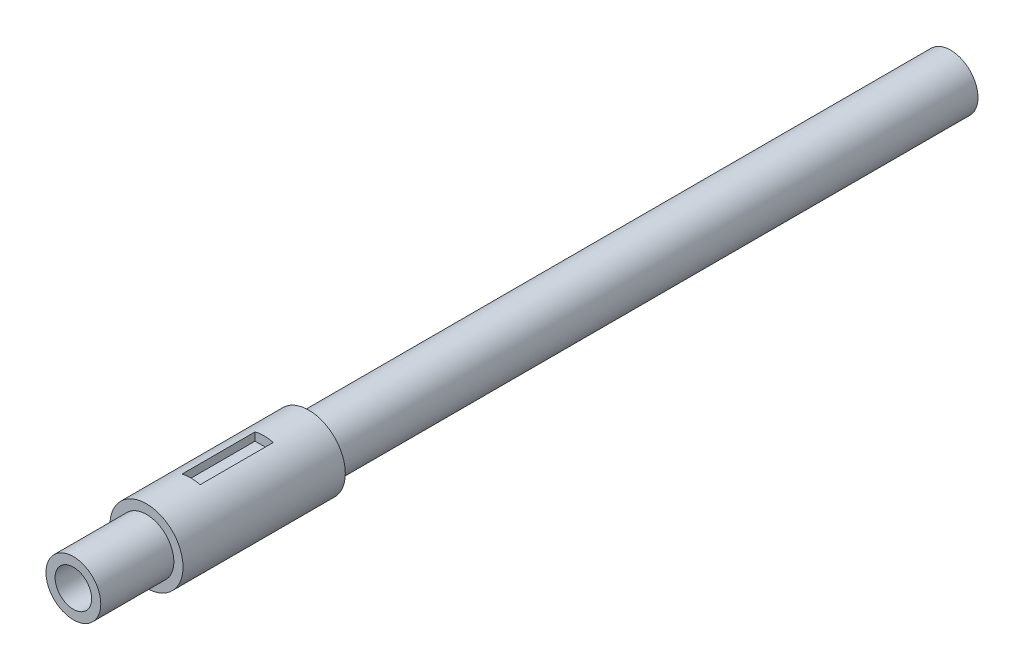
from build123d import *

# Parameters (mm, degrees)
SKETCH1_R           = 12.7
SKETCH1_R_2         = 6.35
BOSS_EXTRUDE1_DEPTH = 304.8
SKETCH3_R           = 19.05
SKETCH3_R_2         = 9.525
CUT_EXTRUDE2_DEPTH  = 254
CUT_EXTRUDE3_DEPTH  = 25.4
CUT_EXTRUDE5_START  = -25.4
SKETCH2_R           = 19.05
SKETCH2_R_2         = 9.525
CUT_EXTRUDE5_DEPTH  = 25.4


with BuildPart() as part:
    # Sketch1 → Boss-Extrude1 (new body)
    with BuildSketch(Plane.XY):
        Circle(SKETCH1_R)
        Circle(SKETCH1_R_2, mode=Mode.SUBTRACT)
    extrude(amount=-BOSS_EXTRUDE1_DEPTH)

    # Sketch3 → Cut-Extrude2 (cut)
    with BuildSketch(Plane.XY.offset(-81.788)):
        Circle(SKETCH3_R)
        Circle(SKETCH3_R_2, mode=Mode.SUBTRACT)
    extrude(amount=-CUT_EXTRUDE2_DEPTH, mode=Mode.SUBTRACT)

    # Sketch4 → Cut-Extrude3 (cut)
    with BuildSketch(Plane.XY.offset(-40.894)):
        Polygon((-3.175, 12.296722124), (-3.175, 15.852722124), (3.175, 15.852722124), (3.175, 12.296722124), (3.175, 9.502722124), (-3.175, 9.502722124), align=None)
    extrude(amount=-CUT_EXTRUDE3_DEPTH, mode=Mode.SUBTRACT)

    # Sketch2 → Cut-Extrude5 (cut)
    with BuildSketch(Plane.XY.offset(CUT_EXTRUDE5_START)):
        Circle(SKETCH2_R)
        Circle(SKETCH2_R_2, mode=Mode.SUBTRACT)
    extrude(amount=CUT_EXTRUDE5_DEPTH, mode=Mode.SUBTRACT)


solid = part.part
